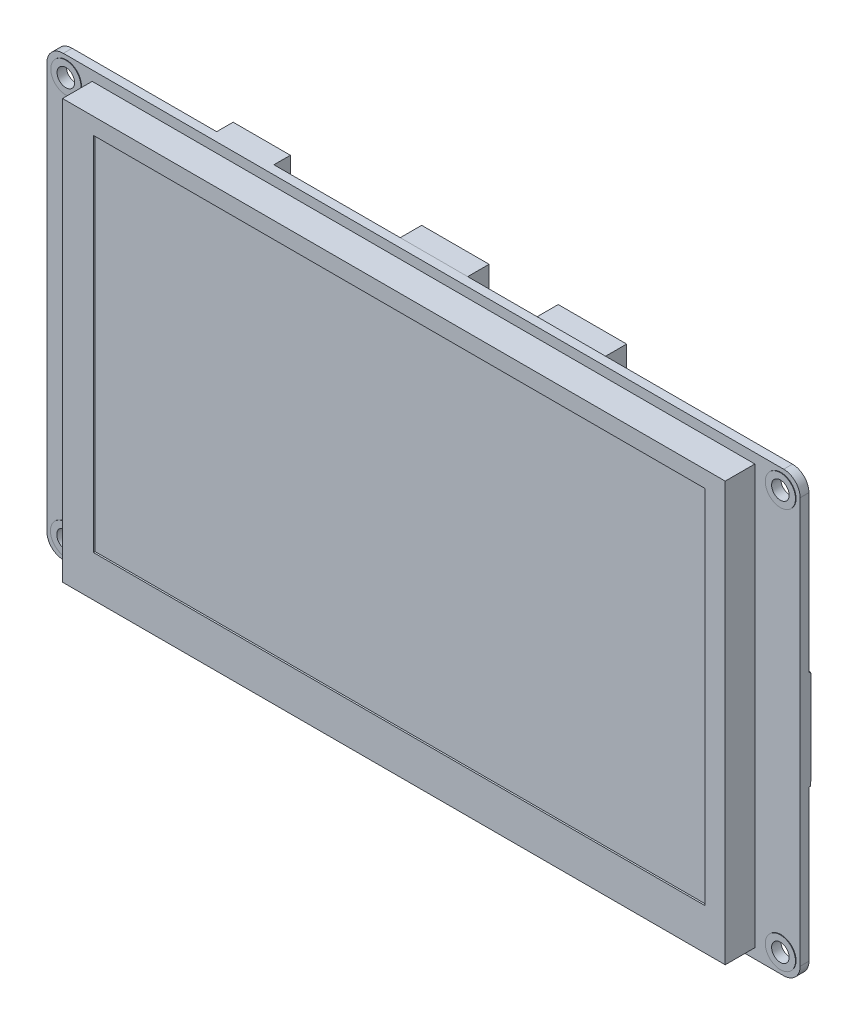
from build123d import *

# Parameters (mm, degrees)
ESQUISSE1_R             = 1.6
BOSS_EXTRU_1_DEPTH      = 1.6
BOSS_EXTRU_2_START      = 0.1
ESQUISSE4_R             = 2.745502256
ESQUISSE4_R_2           = 1.6
ESQUISSE4_R_3           = 2.753289051
ESQUISSE4_R_4           = 2.748627292
ESQUISSE4_R_5           = 2.749087878
BOSS_EXTRU_2_DEPTH      = 0.1
DALLE_ECRAN_W           = 120.7
DALLE_ECRAN_H           = 76.3
BOSS_EXTRU_3_DEPTH      = 5.4
ESQUISSE5_W             = 111.39531855
ESQUISSE5_H             = 65.799743165
ENL_V_MAT_EXTRU_1_DEPTH = 0.3
CNCTEURS_NAPPES_W       = 8.467278196
CNCTEURS_NAPPES_H       = 5.004566259
CNCTEURS_NAPPES_W_2     = 23.468477311
CNCTEURS_NAPPES_H_2     = 4.824937181
BOSS_EXTRU_6_DEPTH      = 1.95000016
USB_AND_BLACK_W         = 7.343229314
USB_AND_BLACK_H         = 8.255214376
USB_AND_BLACK_W_2       = 10.431052769
USB_AND_BLACK_H_2       = 8.822409026
BOSS_EXTRU_7_DEPTH      = 4.6
CONG_1_R                = 1.5
ENL_V_MAT_EXTRU_2_DEPTH = 6.6
SD_CARD_W               = 14.977212961
SD_CARD_H               = 13.888593158
BOSS_EXTRU_8_DEPTH      = 1.87
ESQUISSE14_W            = 13.854063203
ESQUISSE14_H            = 1.078303099
ENL_V_MAT_EXTRU_3_DEPTH = 11.87
JST_STUFF_W             = 12.464239347
JST_STUFF_H             = 7.318452461
JST_STUFF_W_2           = 12.283650858
JST_STUFF_H_2           = 7.475723325
JST_STUFF_W_3           = 5.789078112
JST_STUFF_H_3           = 8.333860366
JST_STUFF_W_4           = 8.480106325
JST_STUFF_H_4           = 6.082535671
BOSS_EXTRU_9_DEPTH      = 5.6
BOSS_EXTRU_10_DEPTH     = 0.3
CORPS_ESP32S3_W         = 25.157910555
CORPS_ESP32S3_H         = 17.038405533
BOSS_EXTRU_11_DEPTH     = 2
BLINDAGE_ESP32_W        = 17.650317649
BLINDAGE_ESP32_H        = 15.529328589
BOSS_EXTRU_12_DEPTH     = 4.6
ESQUISSE15_W            = 3.744471684
ESQUISSE15_H            = 8.283617961
ENL_V_MAT_EXTRU_4_DEPTH = 0.1
ESQUISSE16_W            = 12.283650858
ESQUISSE16_H            = 4
ENL_V_MAT_EXTRU_5_DEPTH = 0.1
ESQUISSE17_W            = 8.480106325
ESQUISSE17_H            = 4
ENL_V_MAT_EXTRU_6_DEPTH = 0.1


with BuildPart() as part:
    # Esquisse1 → Boss.-Extru.1 (new body)
    with BuildSketch(Plane.XY):
        with BuildLine():
            Line((-65.6, -39.95), (65.6, -39.95))
            ThreePointArc((65.6, -39.95), (67.721320344, -39.071320344), (68.6, -36.95))
            Line((68.6, -36.95), (68.6, 36.95))
            ThreePointArc((68.6, 36.95), (67.721320344, 39.071320344), (65.6, 39.95))
            Line((65.6, 39.95), (-65.6, 39.95))
            ThreePointArc((-65.6, 39.95), (-67.721320344, 39.071320344), (-68.6, 36.95))
            Line((-68.6, 36.95), (-68.6, -36.95))
            ThreePointArc((-68.6, -36.95), (-67.721320344, -39.071320344), (-65.6, -39.95))
        make_face()
        with Locations((-65.042999637, 36.45)):
            Circle(ESQUISSE1_R, mode=Mode.SUBTRACT)
        with Locations((65.1, 36.45)):
            Circle(ESQUISSE1_R, mode=Mode.SUBTRACT)
        with Locations((65.1, -36.45)):
            Circle(ESQUISSE1_R, mode=Mode.SUBTRACT)
        with Locations((-65.1, -36.45)):
            Circle(ESQUISSE1_R, mode=Mode.SUBTRACT)
    extrude(amount=-BOSS_EXTRU_1_DEPTH)

    # Esquisse4 → Boss.-Extru.2 (add)
    # profile 1 of 4: a face of its own
    with BuildSketch(Plane.XY.offset(BOSS_EXTRU_2_START)):
        with Locations(Location((-65.042999637, 36.45, 0), (0, 0, 180))):
            Circle(ESQUISSE4_R)
        with Locations((-65.042999637, 36.45)):
            Circle(ESQUISSE4_R_2, mode=Mode.SUBTRACT)
    # profile 2 of 4: a face of its own
    with BuildSketch(Plane.XY.offset(BOSS_EXTRU_2_START)):
        with Locations(Location((65.1, 36.45, 0), (0, 0, 180))):
            Circle(ESQUISSE4_R_3)
        with Locations((65.1, 36.45)):
            Circle(ESQUISSE4_R_2, mode=Mode.SUBTRACT)
    # profile 3 of 4: a face of its own
    with BuildSketch(Plane.XY.offset(BOSS_EXTRU_2_START)):
        with Locations(Location((-65.1, -36.45, 0), (0, 0, 180))):
            Circle(ESQUISSE4_R_4)
        with Locations((-65.1, -36.45)):
            Circle(ESQUISSE4_R_2, mode=Mode.SUBTRACT)
    # profile 4 of 4: a face of its own
    with BuildSketch(Plane.XY.offset(BOSS_EXTRU_2_START)):
        with Locations(Location((65.1, -36.45, 0), (0, 0, 180))):
            Circle(ESQUISSE4_R_5)
        with Locations((65.1, -36.45)):
            Circle(ESQUISSE4_R_2, mode=Mode.SUBTRACT)
    extrude(amount=-BOSS_EXTRU_2_DEPTH)

    # dalle ecran → Boss.-Extru.3 (add)
    with BuildSketch(Plane.XY):
        Rectangle(DALLE_ECRAN_W, DALLE_ECRAN_H)
    extrude(amount=BOSS_EXTRU_3_DEPTH)

    # Esquisse5 → Enlèv. mat.-Extru.1 (cut)
    with BuildSketch(Plane.XY.offset(5.4)):
        with Locations((0.997344022, 2.24811159)):
            Rectangle(ESQUISSE5_W, ESQUISSE5_H)
    extrude(amount=-ENL_V_MAT_EXTRU_1_DEPTH, mode=Mode.SUBTRACT)

    # cncteurs nappes → Boss.-Extru.6 (add)
    with BuildSketch(Plane.XY):
        with Locations((25.63508402, -7.661420705)):
            Rectangle(CNCTEURS_NAPPES_W, CNCTEURS_NAPPES_H)
        with Locations((-24.089692443, 5.387772698)):
            Rectangle(CNCTEURS_NAPPES_W_2, CNCTEURS_NAPPES_H_2)
    extrude(amount=-BOSS_EXTRU_6_DEPTH)

    # usb and black → Boss.-Extru.7 (add)
    with BuildSketch(Plane.XY):
        with Locations((-64.928385343, -0.416064212)):
            Rectangle(USB_AND_BLACK_W, USB_AND_BLACK_H)
        with Locations((-34.061503847, 35.538795487)):
            Rectangle(USB_AND_BLACK_W_2, USB_AND_BLACK_H_2)
    extrude(amount=-BOSS_EXTRU_7_DEPTH)

    # Congé1
    cong_1_edges = [part.edges().sort_by_distance(p)[0] for p in [
        (-64.928385343, 3.711542976, -4.6),
        (-64.928385343, -4.5436714, -4.6),
    ]]
    fillet(cong_1_edges, radius=CONG_1_R)

    # Esquisse13 → Enlèv. mat.-Extru.2 (cut)
    with BuildSketch(Plane.ZY.offset(68.6)):
        with BuildLine():
            Line((-3.405933586, -3.746969664), (-2.31136347, -3.746969664))
            ThreePointArc((-2.31136347, -3.746969664), (-1.95781008, -3.600523055), (-1.81136347, -3.246969664))
            Line((-1.81136347, -3.246969664), (-1.81136347, 2.384308647))
            ThreePointArc((-1.81136347, 2.384308647), (-1.95781008, 2.737862038), (-2.31136347, 2.884308647))
            Line((-2.31136347, 2.884308647), (-3.405933586, 2.884308647))
            ThreePointArc((-3.405933586, 2.884308647), (-3.759486977, 2.737862038), (-3.905933586, 2.384308647))
            Line((-3.905933586, 2.384308647), (-3.905933586, -3.246969664))
            ThreePointArc((-3.905933586, -3.246969664), (-3.759486977, -3.600523055), (-3.405933586, -3.746969664))
        make_face()
    extrude(amount=-ENL_V_MAT_EXTRU_2_DEPTH, mode=Mode.SUBTRACT)

    # sd-card → Boss.-Extru.8 (add)
    with BuildSketch(Plane(origin=(0, 0, -1.6), x_dir=(-1, 0, 0), z_dir=(0, 0, -1))):
        with Locations((46.761919818, -32.169558424)):
            Rectangle(SD_CARD_W, SD_CARD_H)
    extrude(amount=BOSS_EXTRU_8_DEPTH)

    # Esquisse14 → Enlèv. mat.-Extru.3 (cut)
    with BuildSketch(Plane.XZ.offset(39.113855003)):
        with Locations((-46.836436308, -2.488747192)):
            Rectangle(ESQUISSE14_W, ESQUISSE14_H)
    extrude(amount=-ENL_V_MAT_EXTRU_3_DEPTH, mode=Mode.SUBTRACT)

    # JST Stuff → Boss.-Extru.9 (add)
    with BuildSketch(Plane.XY):
        with Locations((25.167454001, 36.133502906)):
            Rectangle(JST_STUFF_W, JST_STUFF_H)
        with Locations((0.202213084, 36.212138338)):
            Rectangle(JST_STUFF_W_2, JST_STUFF_H_2)
        with Locations((-64.931996486, -20.362620573)):
            Rectangle(JST_STUFF_W_3, JST_STUFF_H_3)
        with Locations((47.923233299, -36.908732165)):
            Rectangle(JST_STUFF_W_4, JST_STUFF_H_4)
    extrude(amount=-BOSS_EXTRU_9_DEPTH)

    # embase esp32S3 → Boss.-Extru.10 (add)
    with BuildSketch(Plane(origin=(0, 0, -1.6), x_dir=(-1, 0, 0), z_dir=(0, 0, -1))):
        Polygon((-61.486406808, 8.518102678), (-68.6, 8.518102678), (-68.6, -9.48263925), (-61.356380297, -9.48263925), (-61.356380297, -10.378947345), (-60.486800458, -10.378947345), (-60.486800458, -9.48263925), (-60.086380297, -9.48263925), (-60.086380297, -10.378947345), (-59.216800458, -10.378947345), (-59.216800458, -9.48263925), (-58.816380297, -9.48263925), (-58.816380297, -10.378947345), (-57.946800458, -10.378947345), (-57.946800458, -9.48263925), (-57.546380297, -9.48263925), (-57.546380297, -10.378947345), (-56.676800458, -10.378947345), (-56.676800458, -9.48263925), (-56.276380297, -9.48263925), (-56.276380297, -10.378947345), (-55.406800458, -10.378947345), (-55.406800458, -9.48263925), (-55.006380297, -9.48263925), (-55.006380297, -10.378947345), (-54.136800458, -10.378947345), (-54.136800458, -9.48263925), (-53.736380297, -9.48263925), (-53.736380297, -10.378947345), (-52.866800458, -10.378947345), (-52.866800458, -9.48263925), (-52.466380297, -9.48263925), (-52.466380297, -10.378947345), (-51.596800458, -10.378947345), (-51.596800458, -9.48263925), (-51.196380297, -9.48263925), (-51.196380297, -10.378947345), (-50.326800458, -10.378947345), (-50.326800458, -9.48263925), (-49.926380297, -9.48263925), (-49.926380297, -10.378947345), (-49.056800458, -10.378947345), (-49.056800458, -9.48263925), (-48.656380297, -9.48263925), (-47.786800458, -9.48263925), (-47.386380297, -9.48263925), (-47.386380297, -10.378947345), (-46.516800458, -10.378947345), (-46.516800458, -9.48263925), (-46.116380297, -9.48263925), (-46.116380297, -10.378947345), (-45.246800458, -10.378947345), (-45.246800458, -9.48263925), (-44.846380297, -9.48263925), (-44.846380297, -10.378947345), (-43.976800458, -10.378947345), (-43.976800458, -9.48263925), (-42.819340628, -9.48263925), (-42.819340628, -7.807646878), (-42.021493676, -7.807646878), (-42.021493676, -7.025014139), (-42.819340628, -7.025014139), (-42.819340628, -6.537646878), (-42.021493676, -6.537646878), (-42.021493676, -5.755014139), (-42.819340628, -5.755014139), (-42.819340628, -5.267646878), (-42.021493676, -5.267646878), (-42.021493676, -4.485014139), (-42.819340628, -4.485014139), (-42.819340628, -3.997646878), (-42.021493676, -3.997646878), (-42.021493676, -3.215014139), (-42.819340628, -3.215014139), (-42.819340628, -2.727646878), (-42.021493676, -2.727646878), (-42.021493676, -1.945014139), (-42.819340628, -1.945014139), (-42.819340628, -1.457646878), (-42.021493676, -1.457646878), (-42.021493676, -0.675014139), (-42.819340628, -0.675014139), (-42.819340628, -0.187646878), (-42.021493676, -0.187646878), (-42.021493676, 0.594985861), (-42.819340628, 0.594985861), (-42.819340628, 1.082353122), (-42.021493676, 1.082353122), (-42.021493676, 1.864985861), (-42.819340628, 1.864985861), (-42.819340628, 2.352353122), (-42.021493676, 2.352353122), (-42.021493676, 3.134985861), (-42.819340628, 3.134985861), (-42.819340628, 3.622353122), (-42.021493676, 3.622353122), (-42.021493676, 4.404985861), (-42.819340628, 4.404985861), (-42.819340628, 4.892353122), (-42.021493676, 4.892353122), (-42.021493676, 5.674985861), (-42.819340628, 5.674985861), (-42.819340628, 6.162353122), (-42.021493676, 6.162353122), (-42.021493676, 6.944985861), (-42.819340628, 6.944985861), (-42.819340628, 8.518102678), (-43.948635434, 8.518102678), (-43.948635434, 9.381594763), (-44.976406808, 9.381594763), (-44.976406808, 8.518102678), (-45.218635434, 8.518102678), (-45.218635434, 9.381594763), (-46.246406808, 9.381594763), (-46.246406808, 8.518102678), (-46.488635434, 8.518102678), (-46.488635434, 9.381594763), (-47.516406808, 9.381594763), (-47.516406808, 8.518102678), (-47.758635434, 8.518102678), (-47.758635434, 9.381594763), (-48.786406808, 9.381594763), (-48.786406808, 8.518102678), (-49.028635434, 8.518102678), (-49.028635434, 9.381594763), (-50.056406808, 9.381594763), (-50.056406808, 8.518102678), (-50.298635434, 8.518102678), (-50.298635434, 9.381594763), (-51.326406808, 9.381594763), (-51.326406808, 8.518102678), (-51.568635434, 8.518102678), (-51.568635434, 9.381594763), (-52.596406808, 9.381594763), (-52.596406808, 8.518102678), (-52.838635434, 8.518102678), (-52.838635434, 9.381594763), (-53.866406808, 9.381594763), (-53.866406808, 8.518102678), (-54.108635434, 8.518102678), (-54.108635434, 9.381594763), (-55.136406808, 9.381594763), (-55.136406808, 8.518102678), (-55.378635434, 8.518102678), (-55.378635434, 9.381594763), (-56.406406808, 9.381594763), (-56.406406808, 8.518102678), (-56.648635434, 8.518102678), (-56.648635434, 9.381594763), (-57.676406808, 9.381594763), (-57.676406808, 8.518102678), (-57.918635434, 8.518102678), (-57.918635434, 9.381594763), (-58.946406808, 9.381594763), (-58.946406808, 8.518102678), (-59.188635434, 8.518102678), (-59.188635434, 9.381594763), (-60.216406808, 9.381594763), (-60.216406808, 8.518102678), (-60.458635434, 8.518102678), (-60.458635434, 9.381594763), (-61.486406808, 9.381594763), align=None)
    extrude(amount=BOSS_EXTRU_10_DEPTH)

    # corps esp32S3 → Boss.-Extru.11 (add)
    with BuildSketch(Plane.XY):
        with Locations((56.021044723, -0.269858623)):
            Rectangle(CORPS_ESP32S3_W, CORPS_ESP32S3_H)
    extrude(amount=-BOSS_EXTRU_11_DEPTH)

    # blindage esp32 → Boss.-Extru.12 (add)
    with BuildSketch(Plane.XY):
        with Locations((53.044165737, -0.219086692)):
            Rectangle(BLINDAGE_ESP32_W, BLINDAGE_ESP32_H)
    extrude(amount=-BOSS_EXTRU_12_DEPTH)

    # Esquisse15 → Enlèv. mat.-Extru.4 (cut)
    with BuildSketch(Plane.ZY.offset(68.6)):
        with Locations((-3.472235842, -0.401862419)):
            Rectangle(ESQUISSE15_W, ESQUISSE15_H)
    extrude(amount=-ENL_V_MAT_EXTRU_4_DEPTH, mode=Mode.SUBTRACT)

    # Esquisse16 → Enlèv. mat.-Extru.5 (cut)
    with BuildSketch(Plane(origin=(0, 39.95, 0), x_dir=(1, 0, 0), z_dir=(0, 1, 0))):
        with Locations((0.202213084, 3.6)):
            Rectangle(ESQUISSE16_W, ESQUISSE16_H)
    extrude(amount=-ENL_V_MAT_EXTRU_5_DEPTH, mode=Mode.SUBTRACT)

    # Esquisse17 → Enlèv. mat.-Extru.6 (cut)
    with BuildSketch(Plane.XZ.offset(39.95)):
        with Locations((47.923233299, -3.6)):
            Rectangle(ESQUISSE17_W, ESQUISSE17_H)
    extrude(amount=-ENL_V_MAT_EXTRU_6_DEPTH, mode=Mode.SUBTRACT)


solid = part.part
